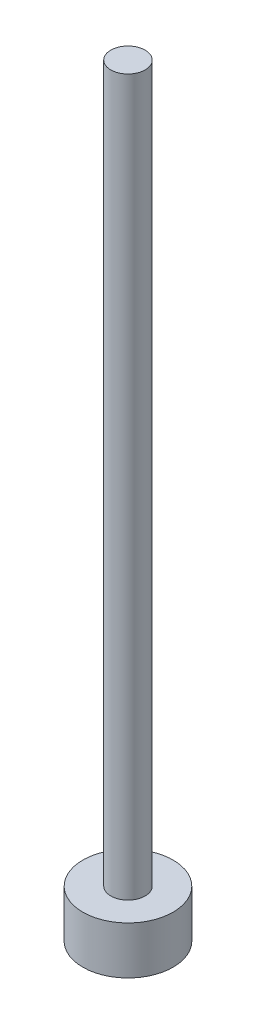
from build123d import *

# Parameters (mm, degrees)
SKETCH1_R           = 2.84
BOSS_EXTRUDE1_DEPTH = 3
SKETCH2_R           = 1.079696648
BOSS_EXTRUDE2_DEPTH = 45
CUT_EXTRUDE1_DEPTH  = 1.4


with BuildPart() as part:
    # Sketch1 → Boss-Extrude1 (new body)
    with BuildSketch(Plane(origin=(0, 0, 0), x_dir=(1, 0, 0), z_dir=(0, 1, 0))):
        with Locations(Location((0, 0, 0), (0, 0, 270))):
            Circle(SKETCH1_R)
    extrude(amount=BOSS_EXTRUDE1_DEPTH)

    # Sketch2 → Boss-Extrude2 (add)
    with BuildSketch(Plane(origin=(0, 3, 0), x_dir=(1, 0, 0), z_dir=(0, 1, 0))):
        with Locations(Location((0, 0, 0), (0, 0, 90))):
            Circle(SKETCH2_R)
    extrude(amount=BOSS_EXTRUDE2_DEPTH)

    # Sketch3 → Cut-Extrude1 (cut)
    with BuildSketch(Plane.XZ):
        Polygon((1.65122177, 0), (0.825610885, 1.43), (-0.825610885, 1.43), (-1.65122177, 0), (-0.825610885, -1.43), (0.825610885, -1.43), align=None)
    extrude(amount=-CUT_EXTRUDE1_DEPTH, mode=Mode.SUBTRACT)


solid = part.part
